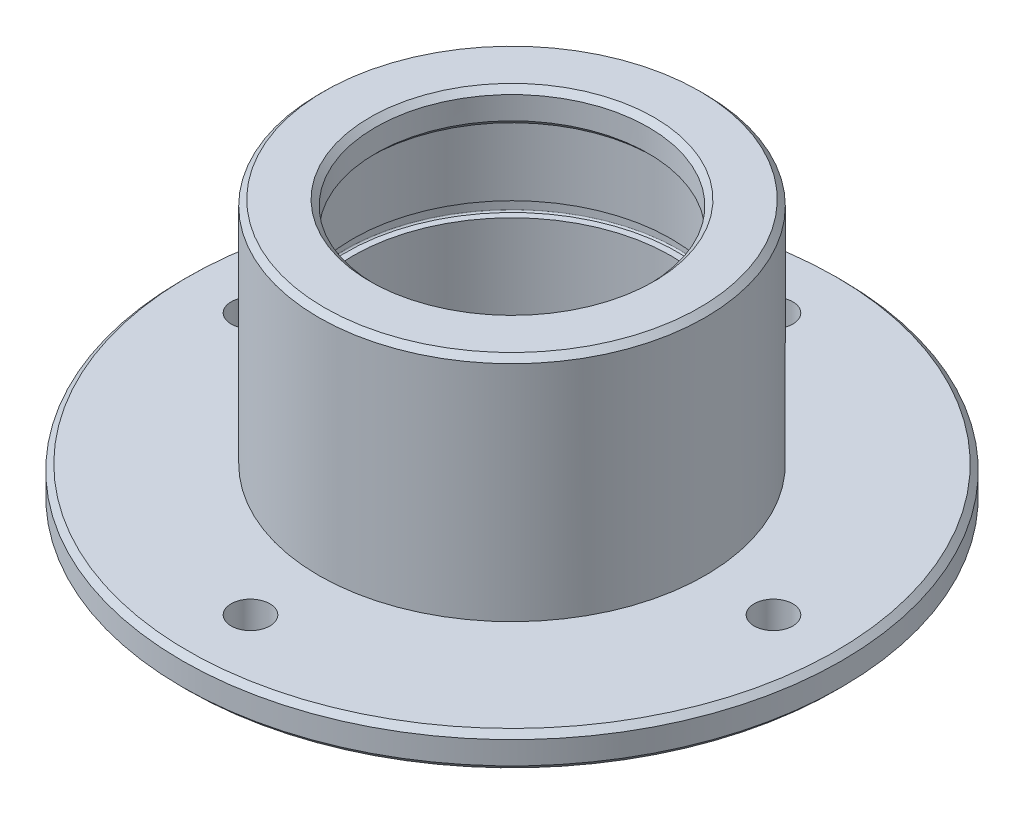
from build123d import *

# Parameters (mm, degrees)
M3_CLEARANCE_HOLE1_D = 3.4
FILLET1_R            = 0.2
CHAMFER1_SIZE        = 0.5


with BuildPart() as part:
    # Sketch1 → Revolve1 (revolve)
    with BuildSketch(Plane.XY, mode=Mode.PRIVATE) as revolve1_sk:
        Polygon((14, -3), (14, 17.15), (12, 17.15), (12, 20.15), (17, 20.15), (17, 0), (29, 0), (29, -3), align=None)
    revolve(revolve1_sk.sketch.rotate(Axis((0, 17.954019247, 0), (0, -1, 0)), 90), axis=Axis((0, 17.954019247, 0), (0, -1, 0)))

    # M3 Clearance Hole1 (through all)
    with Locations(Plane(origin=(0, 0, 0), x_dir=(1, 0, 0), z_dir=(0, 1, 0))):
        with Locations((0, 23), (23, 0), (0, -23), (-23, 0)):
            Hole(M3_CLEARANCE_HOLE1_D / 2)

    # Fillet1
    fillet1_edges = [part.edges().sort_by_distance(p)[0] for p in [
        (0, 17.15, -14),
    ]]
    fillet(fillet1_edges, radius=FILLET1_R)

    # Chamfer1
    chamfer1_edges = [part.edges().sort_by_distance(p)[0] for p in [
        (0, 17.15, -12),
        (0, 20.15, -12),
        (0, 20.15, -17),
        (0, 0, -29),
        (0, -3, -29),
        (0, -3, -14),
    ]]
    chamfer(chamfer1_edges, length=CHAMFER1_SIZE)

    # Sketch8 → Groove for BS 3673 P4 - B028M, Internal Circlip1 (revolve, cut)
    with BuildSketch(Plane(origin=(0, 17.954019247, 0), x_dir=(0, 0, 1), z_dir=(-1, 0, 0))):
        with BuildLine():
            Line((14.57, -9.104019247), (12.6, -9.104019247))
            Line((12.6, -9.104019247), (12.6, -7.804019247))
            Line((12.6, -7.804019247), (14.57, -7.804019247))
            ThreePointArc((14.57, -7.804019247), (14.661923882, -7.842095365), (14.7, -7.934019247))
            Line((14.7, -7.934019247), (14.7, -8.974019247))
            ThreePointArc((14.7, -8.974019247), (14.661923882, -9.065943128), (14.57, -9.104019247))
        make_face()
    revolve(axis=Axis((0, -32.045980753, 0), (0, 1, 0)), mode=Mode.SUBTRACT)


solid = part.part
